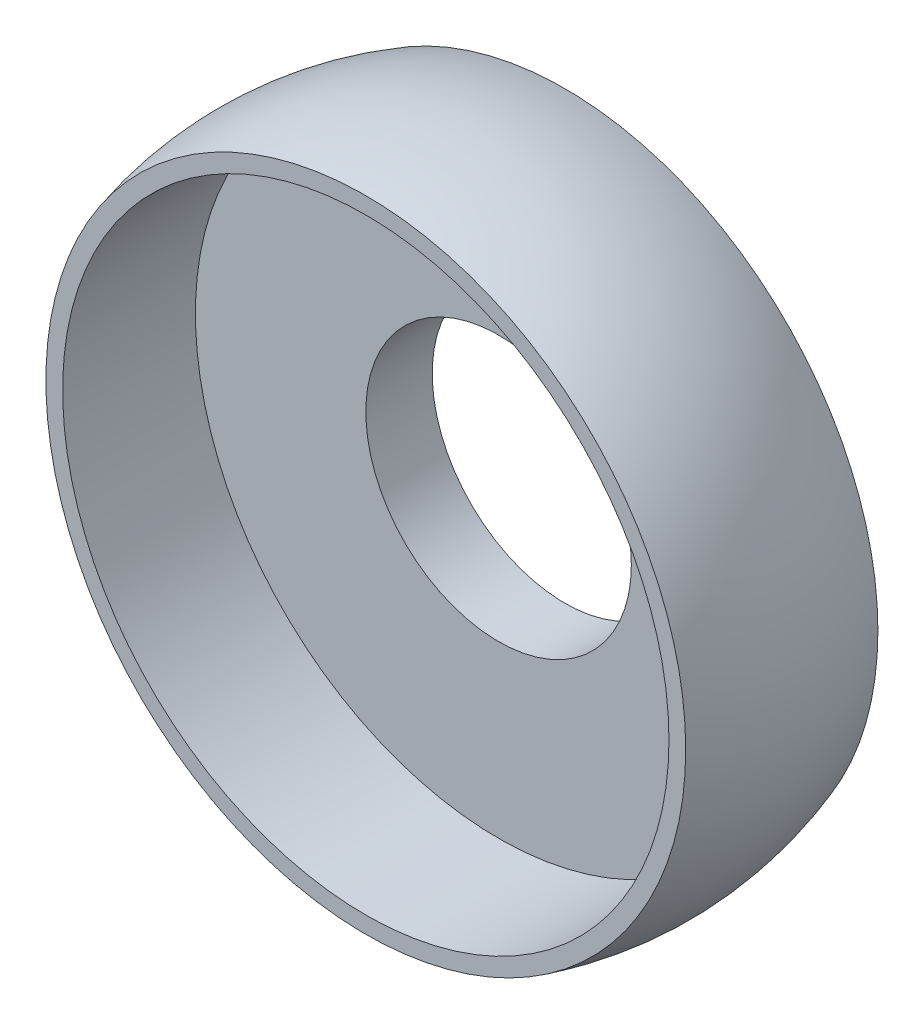
from build123d import *

# Parameters (mm, degrees)
SKETCH_4_R               = 9.762429494
CUT_EXTRUDE_1_DEPTH      = 15.239030866
SKETCH_5_R               = 6.85
CUT_EXTRUDE_2_DEPTH      = 3
CUT_EXTRUDE_3_DEPTH      = 14.592277219
CUT_EXTRUDE_3_DEPTH_BACK = 14.592277219
SKETCH_7_R               = 3
SKETCH_8_R               = 10.169140768
CUT_EXTRUDE_4_DEPTH      = 15.577379737


with BuildPart() as part:
    # 草图1 → 旋转2 (revolve)
    with BuildSketch(Plane.XY):
        with BuildLine():
            Line((-7.5, 0), (7.5, 0))
            ThreePointArc((7.5, 0), (0, 7.5), (-7.5, 0))
        make_face()
    revolve(axis=Axis((-7.5, 0, 0), (1, 0, 0)))

    # 草图4 → 切除-拉伸1 (cut, through all)
    with BuildSketch(Plane.XY.offset(2)):
        Circle(SKETCH_4_R)
    extrude(amount=CUT_EXTRUDE_1_DEPTH, mode=Mode.SUBTRACT)

    # 草图5 → 切除-拉伸2 (cut)
    with BuildSketch(Plane.XY.offset(2)):
        Circle(SKETCH_5_R)
    extrude(amount=-CUT_EXTRUDE_2_DEPTH, mode=Mode.SUBTRACT)

    # 草图7 → 切除-拉伸3 (cut, two sides: drawn at the far end of the back side and taken through both)
    with BuildSketch(Plane.XY.offset(-1).offset(-CUT_EXTRUDE_3_DEPTH_BACK)):
        Circle(SKETCH_7_R)
    extrude(amount=CUT_EXTRUDE_3_DEPTH + CUT_EXTRUDE_3_DEPTH_BACK, mode=Mode.SUBTRACT)

    # 草图8 → 切除-拉伸4 (cut, through all)
    with BuildSketch(Plane.XY.offset(-2.5)):
        Circle(SKETCH_8_R)
    extrude(amount=-CUT_EXTRUDE_4_DEPTH, mode=Mode.SUBTRACT)


solid = part.part
